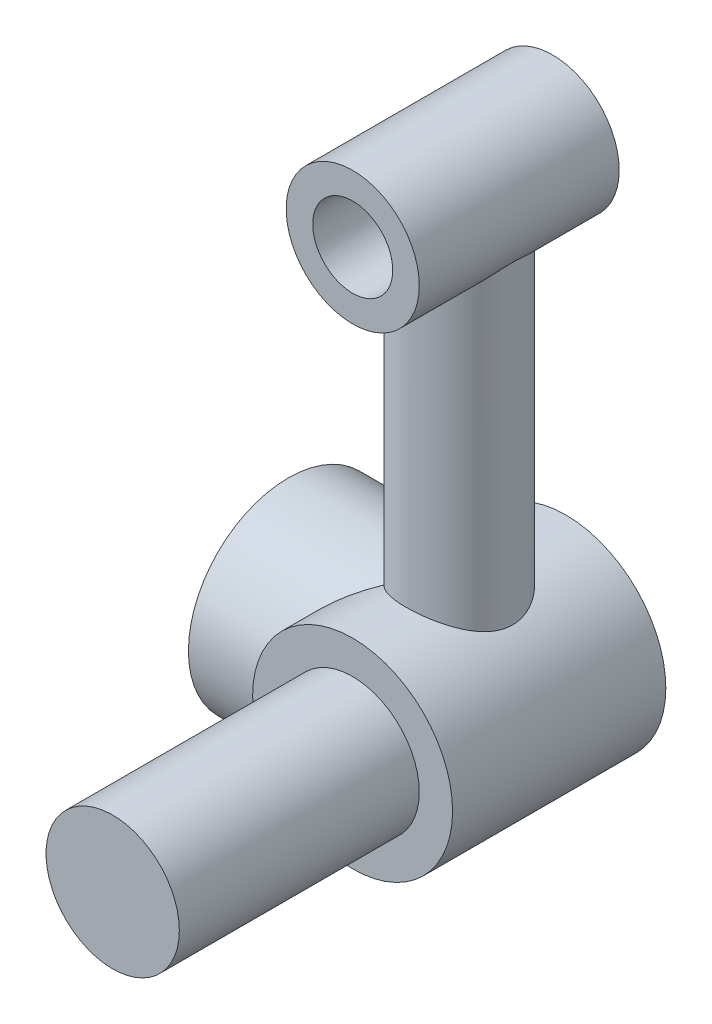
from build123d import *

# Parameters (mm, degrees)
SKETCH1_R           = 50
BOSS_EXTRUDE1_DEPTH = 180
SKETCH2_R           = 75
BOSS_EXTRUDE2_DEPTH = 160
SKETCH3_R           = 75
BOSS_EXTRUDE3_DEPTH = 128.18
SKETCH6_R           = 40
BOSS_EXTRUDE6_DEPTH = 300
SKETCH7_R           = 49.929591809
SKETCH7_R_2         = 30
BOSS_EXTRUDE7_DEPTH = 150


with BuildPart() as part:
    # Sketch1 → Boss-Extrude1 (new body)
    with BuildSketch(Plane.XY):
        with Locations((-700, 1796)):
            Circle(SKETCH1_R)
    extrude(amount=-BOSS_EXTRUDE1_DEPTH)

    # Sketch2 → Boss-Extrude2 (add)
    with BuildSketch(Plane(origin=(0, 0, -180), x_dir=(-1, 0, 0), z_dir=(0, 0, -1))):
        with Locations((700, 1796)):
            Circle(SKETCH2_R)
    extrude(amount=BOSS_EXTRUDE2_DEPTH)

    # Sketch3 → Boss-Extrude3 (add)
    with BuildSketch(Plane(origin=(-700, 0, 0), x_dir=(0, 0, -1), z_dir=(1, 0, 0))):
        with Locations((260, 1796)):
            Circle(SKETCH3_R)
    extrude(amount=-BOSS_EXTRUDE3_DEPTH)

    # Sketch6 → Boss-Extrude6 (add)
    with BuildSketch(Plane(origin=(0, 1795, 0), x_dir=(-1, 0, 0), z_dir=(0, 1, 0))):
        with Locations(Location((700, -260, 0), (0, 0, 314.999999875))):
            Circle(SKETCH6_R)
    extrude(amount=BOSS_EXTRUDE6_DEPTH)

    # Sketch7 → Boss-Extrude7 (add)
    with BuildSketch(Plane.XY.offset(-180)):
        with Locations((-699.911954828, 2125)):
            Circle(SKETCH7_R)
        with Locations((-699.911954828, 2125)):
            Circle(SKETCH7_R_2, mode=Mode.SUBTRACT)
    extrude(amount=-BOSS_EXTRUDE7_DEPTH)


solid = part.part
